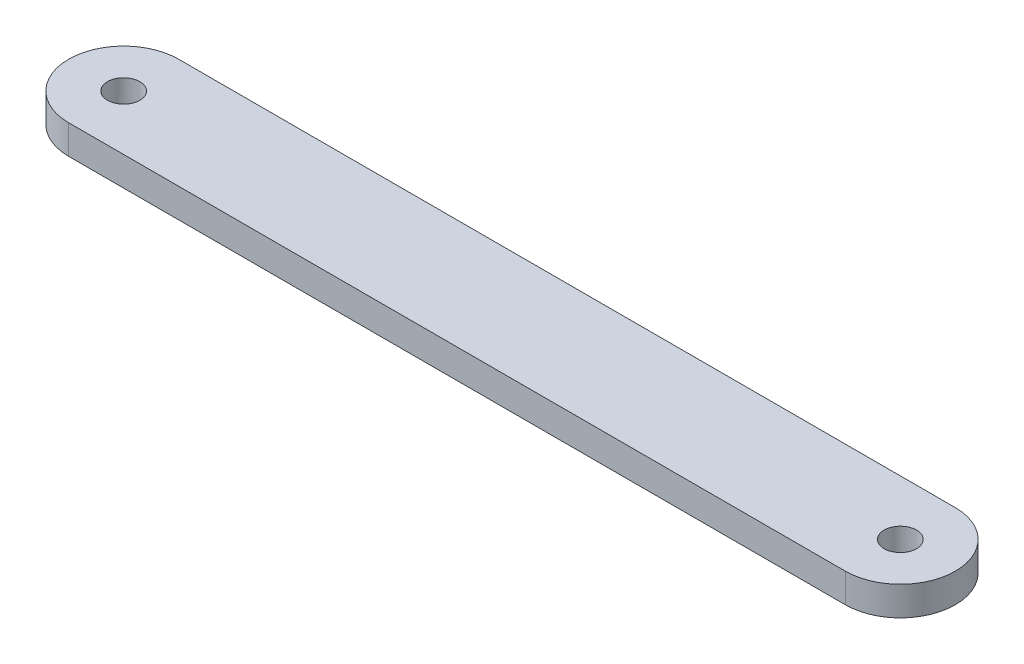
from build123d import *

# Parameters (mm, degrees)
SKETCH1_R           = 8.5
SKETCH1_R_2         = 2.5
BOSS_EXTRUDE2_DEPTH = 4.5


with BuildPart() as part:
    # Sketch1 → Boss-Extrude2 (new body)
    # profile 1 of 3: a face of its own
    with BuildSketch(Plane(origin=(0, 0, 0), x_dir=(1, 0, 0), z_dir=(0, 1, 0))):
        with BuildLine():
            Line((0, 8.5), (-120, 8.5))
            ThreePointArc((-120, 8.5), (-113.98959236, 6.01040764), (-111.5, 0))
            ThreePointArc((-111.5, 0), (-113.98959236, -6.01040764), (-120, -8.5))
            Line((-120, -8.5), (0, -8.5))
            ThreePointArc((0, -8.5), (-8.5, 0), (0, 8.5))
        make_face()
    # profile 2 of 3: a face of its own
    with BuildSketch(Plane(origin=(0, 0, 0), x_dir=(1, 0, 0), z_dir=(0, 1, 0))):
        with Locations((-120, 0)):
            Circle(SKETCH1_R)
        with Locations(Location((-120, 0, 0), (0, 0, 270))):
            Circle(SKETCH1_R_2, mode=Mode.SUBTRACT)
    # profile 3 of 3: a face of its own
    with BuildSketch(Plane(origin=(0, 0, 0), x_dir=(1, 0, 0), z_dir=(0, 1, 0))):
        Circle(SKETCH1_R)
        with Locations(Location((0, 0, 0), (0, 0, 270))):
            Circle(SKETCH1_R_2, mode=Mode.SUBTRACT)
    extrude(amount=BOSS_EXTRUDE2_DEPTH)


solid = part.part
